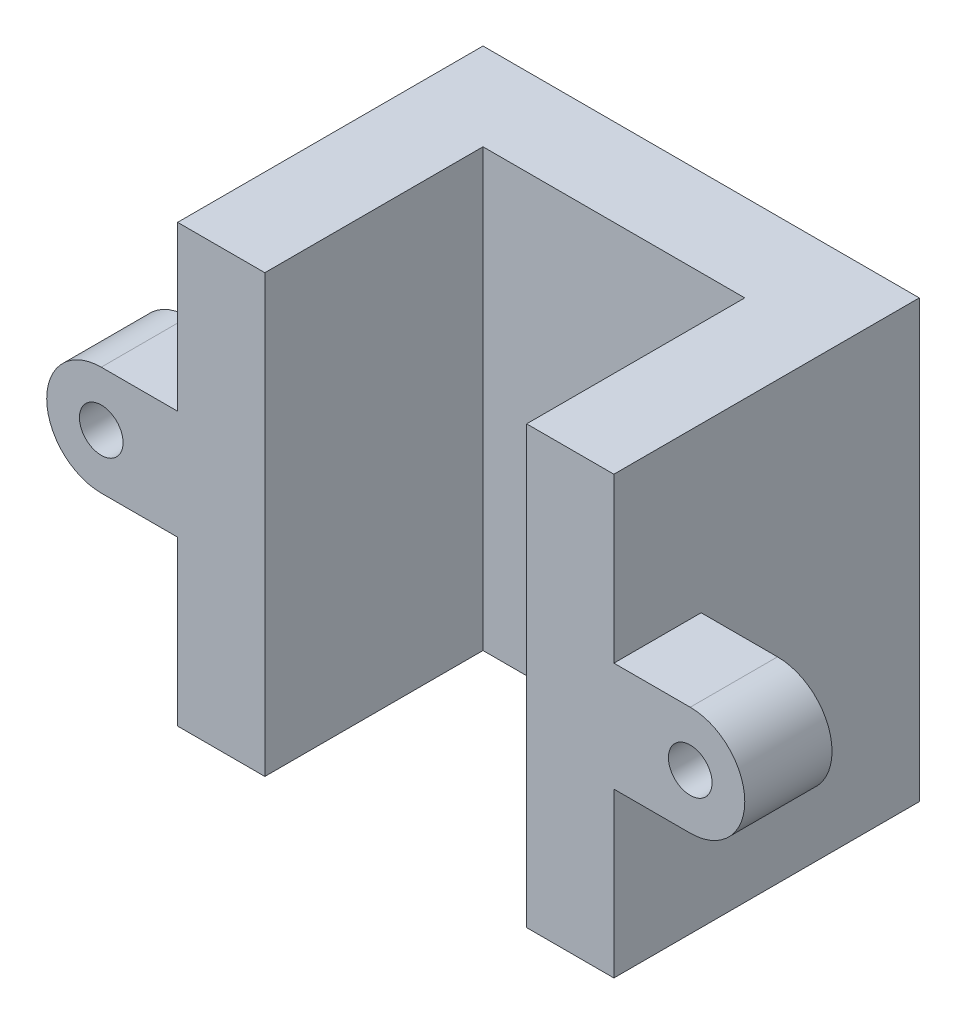
from build123d import *

# Parameters (mm, degrees)
BOSS_EXTRUDE1_DEPTH = 20
SKETCH2_W           = 4
SKETCH2_H           = 12
BOSS_EXTRUDE2_DEPTH = 6
SKETCH3_R           = 1
CUT_EXTRUDE1_DEPTH  = 6
CUT_EXTRUDE2_DEPTH  = 2


with BuildPart() as part:
    # Sketch1 → Boss-Extrude1 (new body)
    with BuildSketch(Plane(origin=(0, 0, 0), x_dir=(1, 0, 0), z_dir=(0, 1, 0))):
        Polygon((-6, -5), (-10, -5), (-10, 9), (10, 9), (10, -5), (6, -5), (6, 5), (-6, 5), align=None)
    extrude(amount=BOSS_EXTRUDE1_DEPTH)

    # Sketch2 → Boss-Extrude2 (add)
    with BuildSketch(Plane(origin=(10, 0, 0), x_dir=(0, 0, -1), z_dir=(1, 0, 0))):
        with Locations((-3, 10)):
            Rectangle(SKETCH2_W, SKETCH2_H)
    boss_extrude2 = extrude(amount=BOSS_EXTRUDE2_DEPTH)

    # Sketch3 → Cut-Extrude1 (cut)
    with BuildSketch(Plane(origin=(0, 0, 1), x_dir=(-1, 0, 0), z_dir=(0, 0, -1))):
        with BuildLine():
            Line((-16, 4), (-10, 4))
            Line((-10, 4), (-10, 7.5))
            Line((-10, 7.5), (-13.5, 7.5))
            ThreePointArc((-13.5, 7.5), (-15.267766953, 8.232233047), (-16, 10))
            Line((-16, 10), (-16, 4))
        make_face()
        with Locations(Location((-13.5, 10, 0), (0, 0, 90))):
            Circle(SKETCH3_R)
        with BuildLine():
            Line((-16, 16), (-16, 10))
            ThreePointArc((-16, 10), (-15.267766953, 11.767766953), (-13.5, 12.5))
            Line((-13.5, 12.5), (-10, 12.5))
            Line((-10, 12.5), (-10, 16))
            Line((-10, 16), (-16, 16))
        make_face()
    cut_extrude1 = extrude(amount=-CUT_EXTRUDE1_DEPTH, mode=Mode.SUBTRACT)

    # Sketch4 → Cut-Extrude2 (cut)
    with BuildSketch(Plane(origin=(0, 0, 1), x_dir=(-1, 0, 0), z_dir=(0, 0, -1))):
        Polygon((-13.5, 11.75), (-15.015544457, 10.875), (-15.015544457, 9.125), (-13.5, 8.25), (-11.984455543, 9.125), (-11.984455543, 10.875), align=None)
    cut_extrude2 = extrude(amount=-CUT_EXTRUDE2_DEPTH, mode=Mode.SUBTRACT)

    # Mirror1: Boss-Extrude2, Cut-Extrude1, Cut-Extrude2 across plane
    add(boss_extrude2.mirror(Plane(origin=(0, 0, 0), x_dir=(0, 0, 1), z_dir=(1, 0, 0))))
    add(cut_extrude1.mirror(Plane(origin=(0, 0, 0), x_dir=(0, 0, 1), z_dir=(1, 0, 0))), mode=Mode.SUBTRACT)
    add(cut_extrude2.mirror(Plane(origin=(0, 0, 0), x_dir=(0, 0, 1), z_dir=(1, 0, 0))), mode=Mode.SUBTRACT)


solid = part.part
